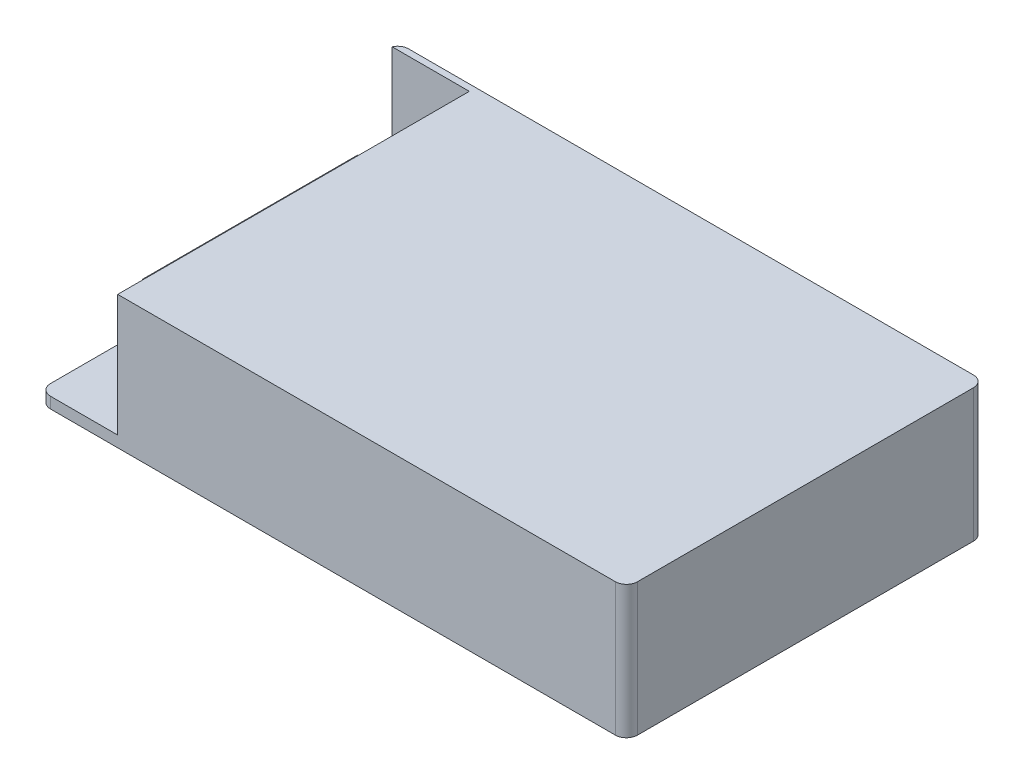
from build123d import *

# Parameters (mm, degrees)
BOSS_EXTRUDE1_DEPTH = 36
SKETCH2_W           = 25.092767626
SKETCH2_H           = 98.018623539
CUT_EXTRUDE1_DEPTH  = 33
SKETCH3_W           = 21.186114989
SKETCH3_H           = 58.288408131
BOSS_EXTRUDE2_DEPTH = 12


with BuildPart() as part:
    # Sketch1 → Boss-Extrude1 (new body)
    with BuildSketch(Plane(origin=(0, 0, 0), x_dir=(1, 0, 0), z_dir=(0, 1, 0))):
        with BuildLine():
            Line((-76.5, 48.5), (76.5, 48.5))
            ThreePointArc((76.5, 48.5), (78.621320344, 47.621320344), (79.5, 45.5))
            Line((79.5, 45.5), (79.5, -45.5))
            ThreePointArc((79.5, -45.5), (78.621320344, -47.621320344), (76.5, -48.5))
            Line((76.5, -48.5), (-76.5, -48.5))
            ThreePointArc((-76.5, -48.5), (-78.621320344, -47.621320344), (-79.5, -45.5))
            Line((-79.5, -45.5), (-79.5, 45.5))
            ThreePointArc((-79.5, 45.5), (-78.621320344, 47.621320344), (-76.5, 48.5))
        make_face()
    extrude(amount=BOSS_EXTRUDE1_DEPTH)

    # Sketch2 → Cut-Extrude1 (cut)
    with BuildSketch(Plane(origin=(0, 36, 0), x_dir=(1, 0, 0), z_dir=(0, 1, 0))):
        with Locations((-70.860268824, -2.253243676)):
            Rectangle(SKETCH2_W, SKETCH2_H)
    extrude(amount=-CUT_EXTRUDE1_DEPTH, mode=Mode.SUBTRACT)


with BuildPart() as body_2:
    # Sketch3 → Boss-Extrude2 (new body)
    with BuildSketch(Plane(origin=(0, 3, 0), x_dir=(1, 0, 0), z_dir=(0, 1, 0))):
        with Locations((-68.906942505, 8.560293123)):
            Rectangle(SKETCH3_W, SKETCH3_H)
    extrude(amount=BOSS_EXTRUDE2_DEPTH)


solid = Compound([part.part, body_2.part])
